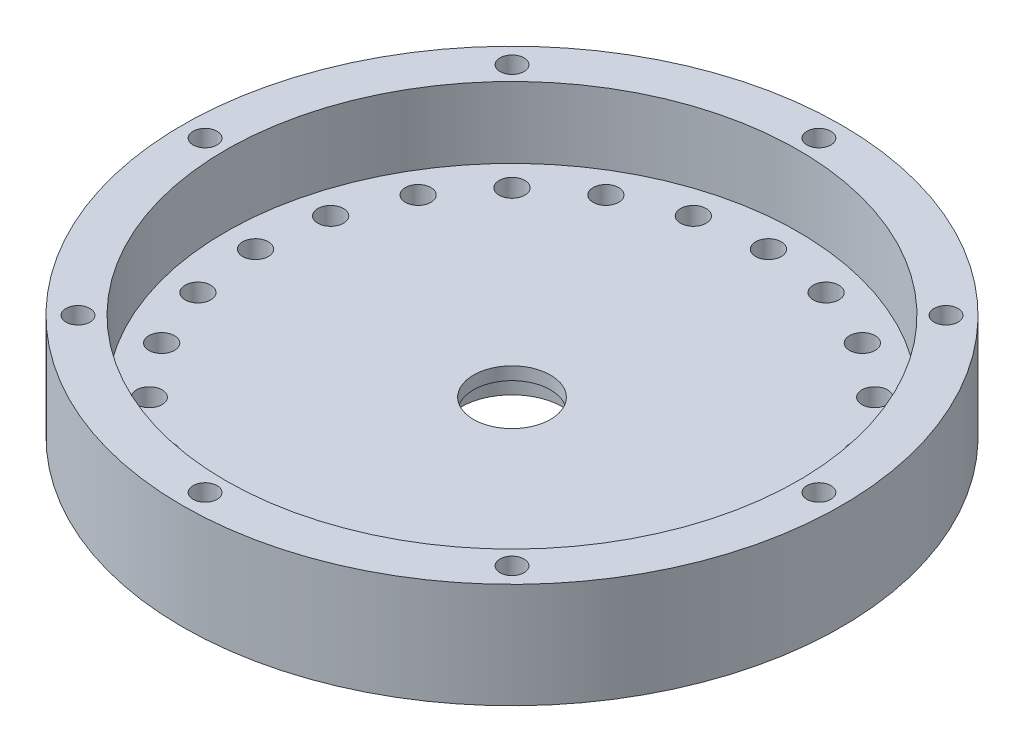
from build123d import *

# Parameters (mm, degrees)
SKETCH1_R           = 77.1
BOSS_EXTRUDE1_DEPTH = 24.6
SKETCH2_R           = 67
CUT_EXTRUDE1_DEPTH  = 16.6
SKETCH3_R           = 3
CUT_EXTRUDE2_DEPTH  = 5
SKETCH4_R           = 12
CUT_EXTRUDE3_DEPTH  = 5
SKETCH5_R           = 9
CUT_EXTRUDE4_DEPTH  = 5
SKETCH6_R           = 2.8
CUT_EXTRUDE5_DEPTH  = 8


with BuildPart() as part:
    # Sketch1 → Boss-Extrude1 (new body)
    with BuildSketch(Plane(origin=(0, 0, 0), x_dir=(1, 0, 0), z_dir=(0, 1, 0))):
        with Locations(Location((0, 0, 0), (0, 0, 270))):
            Circle(SKETCH1_R)
    extrude(amount=BOSS_EXTRUDE1_DEPTH)

    # Sketch2 → Cut-Extrude1 (cut)
    with BuildSketch(Plane(origin=(0, 24.6, 0), x_dir=(1, 0, 0), z_dir=(0, 1, 0))):
        with Locations(Location((0, 0, 0), (0, 0, 270))):
            Circle(SKETCH2_R)
    extrude(amount=-CUT_EXTRUDE1_DEPTH, mode=Mode.SUBTRACT)

    # Sketch3 → Cut-Extrude2 (cut)
    with BuildSketch(Plane(origin=(0, 8, 0), x_dir=(1, 0, 0), z_dir=(0, 1, 0))):
        with Locations(Location((60, 0, 0), (0, 0, 270))):
            Circle(SKETCH3_R)
        with Locations(Location((57.955549577, -15.529142706, 0), (0, 0, 270))):
            Circle(SKETCH3_R)
        with Locations(Location((51.961524227, -30, 0), (0, 0, 270))):
            Circle(SKETCH3_R)
        with Locations(Location((42.426406871, -42.426406871, 0), (0, 0, 270))):
            Circle(SKETCH3_R)
        with Locations(Location((30, -51.961524227, 0), (0, 0, 270))):
            Circle(SKETCH3_R)
        with Locations(Location((15.529142706, -57.955549577, 0), (0, 0, 270))):
            Circle(SKETCH3_R)
        with Locations(Location((0, -60, 0), (0, 0, 270))):
            Circle(SKETCH3_R)
        with Locations(Location((-15.529142706, -57.955549577, 0), (0, 0, 270))):
            Circle(SKETCH3_R)
        with Locations(Location((-30, -51.961524227, 0), (0, 0, 270))):
            Circle(SKETCH3_R)
        with Locations(Location((-42.426406871, -42.426406871, 0), (0, 0, 270))):
            Circle(SKETCH3_R)
        with Locations(Location((-51.961524227, -30, 0), (0, 0, 270))):
            Circle(SKETCH3_R)
        with Locations(Location((-57.955549577, -15.529142706, 0), (0, 0, 270))):
            Circle(SKETCH3_R)
        with Locations(Location((-60, 0, 0), (0, 0, 270))):
            Circle(SKETCH3_R)
        with Locations(Location((-57.955549577, 15.529142706, 0), (0, 0, 270))):
            Circle(SKETCH3_R)
        with Locations(Location((-51.961524227, 30, 0), (0, 0, 270))):
            Circle(SKETCH3_R)
        with Locations(Location((-42.426406871, 42.426406871, 0), (0, 0, 270))):
            Circle(SKETCH3_R)
        with Locations(Location((-30, 51.961524227, 0), (0, 0, 270))):
            Circle(SKETCH3_R)
        with Locations(Location((-15.529142706, 57.955549577, 0), (0, 0, 270))):
            Circle(SKETCH3_R)
        with Locations(Location((0, 60, 0), (0, 0, 270))):
            Circle(SKETCH3_R)
        with Locations(Location((15.529142706, 57.955549577, 0), (0, 0, 270))):
            Circle(SKETCH3_R)
        with Locations(Location((30, 51.961524227, 0), (0, 0, 270))):
            Circle(SKETCH3_R)
        with Locations(Location((42.426406871, 42.426406871, 0), (0, 0, 270))):
            Circle(SKETCH3_R)
        with Locations(Location((51.961524227, 30, 0), (0, 0, 270))):
            Circle(SKETCH3_R)
        with Locations(Location((57.955549577, 15.529142706, 0), (0, 0, 270))):
            Circle(SKETCH3_R)
    extrude(amount=-CUT_EXTRUDE2_DEPTH, mode=Mode.SUBTRACT)

    # Sketch4 → Cut-Extrude3 (cut)
    with BuildSketch(Plane.XZ):
        with Locations(Location((0, 0, 0), (0, 0, 270))):
            Circle(SKETCH4_R)
    extrude(amount=-CUT_EXTRUDE3_DEPTH, mode=Mode.SUBTRACT)

    # Sketch5 → Cut-Extrude4 (cut)
    with BuildSketch(Plane(origin=(0, 8, 0), x_dir=(1, 0, 0), z_dir=(0, 1, 0))):
        with Locations(Location((0, 0, 0), (0, 0, 270))):
            Circle(SKETCH5_R)
    extrude(amount=-CUT_EXTRUDE4_DEPTH, mode=Mode.SUBTRACT)

    # Sketch6 → Cut-Extrude5 (cut)
    with BuildSketch(Plane(origin=(0, 24.6, 0), x_dir=(1, 0, 0), z_dir=(0, 1, 0))):
        with Locations(Location((0, 71.8, 0), (0, 0, 270))):
            Circle(SKETCH6_R)
        with Locations(Location((50.770266889, 50.770266889, 0), (0, 0, 270))):
            Circle(SKETCH6_R)
        with Locations(Location((71.8, 0, 0), (0, 0, 270))):
            Circle(SKETCH6_R)
        with Locations(Location((50.770266889, -50.770266889, 0), (0, 0, 270))):
            Circle(SKETCH6_R)
        with Locations(Location((0, -71.8, 0), (0, 0, 270))):
            Circle(SKETCH6_R)
        with Locations(Location((-50.770266889, -50.770266889, 0), (0, 0, 270))):
            Circle(SKETCH6_R)
        with Locations(Location((-71.8, 0, 0), (0, 0, 270))):
            Circle(SKETCH6_R)
        with Locations(Location((-50.770266889, 50.770266889, 0), (0, 0, 270))):
            Circle(SKETCH6_R)
    extrude(amount=-CUT_EXTRUDE5_DEPTH, mode=Mode.SUBTRACT)


solid = part.part
